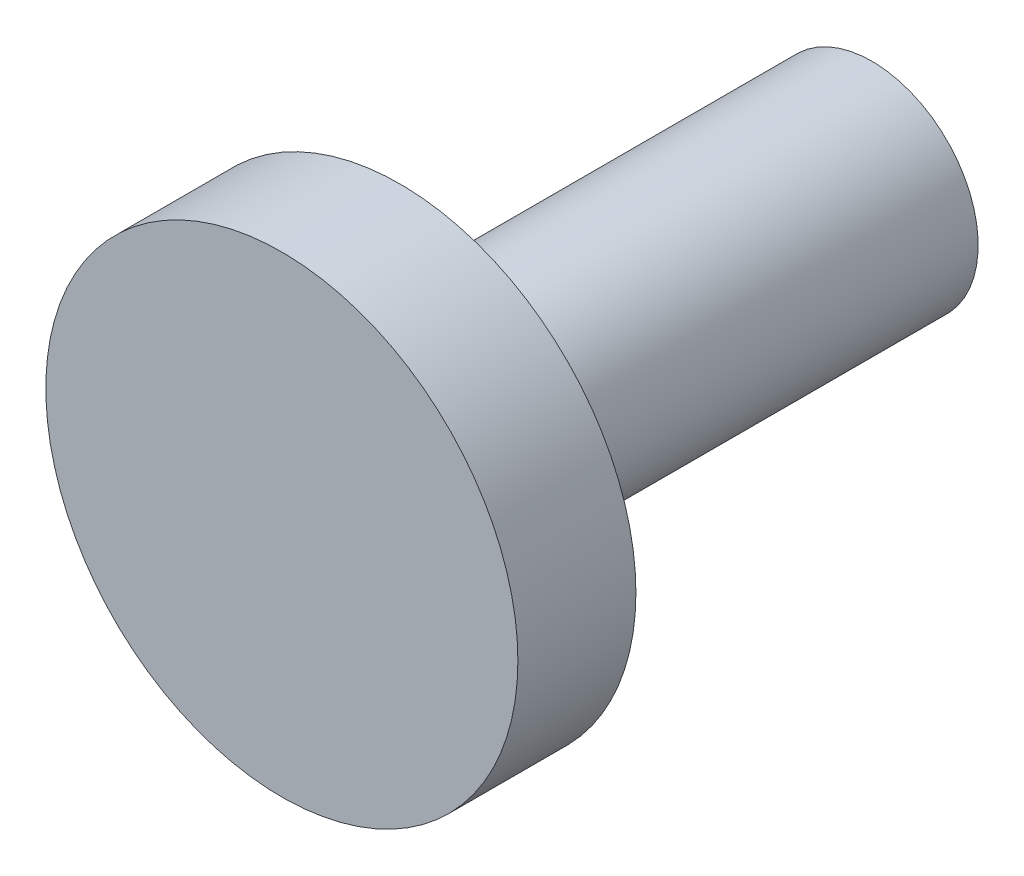
from build123d import *

# Parameters (mm, degrees)
SKETCH1_R           = 5
BOSS_EXTRUDE1_DEPTH = 2.5
SKETCH2_R           = 2.25
BOSS_EXTRUDE2_DEPTH = 10
SKETCH3_R           = 1.25
CUT_EXTRUDE1_DEPTH  = 10


with BuildPart() as part:
    # Sketch1 → Boss-Extrude1 (new body)
    with BuildSketch(Plane.XY):
        Circle(SKETCH1_R)
    extrude(amount=BOSS_EXTRUDE1_DEPTH)

    # Sketch2 → Boss-Extrude2 (add)
    with BuildSketch(Plane(origin=(0, 0, 0), x_dir=(-1, 0, 0), z_dir=(0, 0, -1))):
        Circle(SKETCH2_R)
    extrude(amount=BOSS_EXTRUDE2_DEPTH)

    # Sketch3 → Cut-Extrude1 (cut)
    with BuildSketch(Plane(origin=(0, 0, -10), x_dir=(-1, 0, 0), z_dir=(0, 0, -1))):
        Circle(SKETCH3_R)
    extrude(amount=-CUT_EXTRUDE1_DEPTH, mode=Mode.SUBTRACT)


solid = part.part
